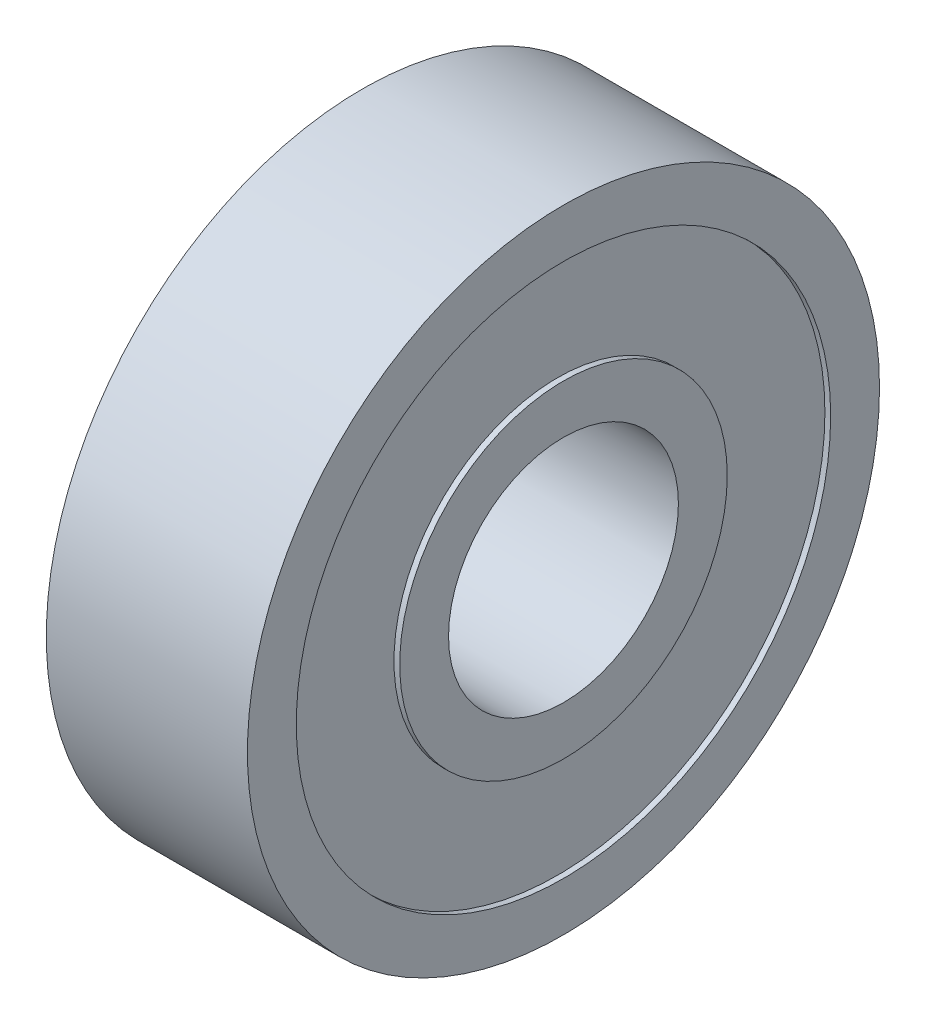
from build123d import *

# Parameters (mm, degrees)
ESQUISSE1_R             = 11
ESQUISSE1_R_2           = 4
BOSS_EXTRU_1_DEPTH      = 3.5
ESQUISSE2_R             = 9.3
ESQUISSE2_R_2           = 5.7
ENL_V_MAT_EXTRU_1_DEPTH = 0.2


with BuildPart() as part:
    # Esquisse1 → Boss.-Extru.1 (new, symmetric)
    with BuildSketch(Plane(origin=(0, 0, 0), x_dir=(0, 0, -1), z_dir=(1, 0, 0))):
        Circle(ESQUISSE1_R)
        Circle(ESQUISSE1_R_2, mode=Mode.SUBTRACT)
    extrude(amount=BOSS_EXTRU_1_DEPTH, both=True)

    # Esquisse2 → Enlèv. mat.-Extru.1 (cut)
    with BuildSketch(Plane(origin=(3.5, 0, 0), x_dir=(0, 0, -1), z_dir=(1, 0, 0))):
        Circle(ESQUISSE2_R)
        Circle(ESQUISSE2_R_2, mode=Mode.SUBTRACT)
    enl_v_mat_extru_1 = extrude(amount=-ENL_V_MAT_EXTRU_1_DEPTH, mode=Mode.SUBTRACT)

    # Symétrie1: Enlèv. mat.-Extru.1 across plane
    add(enl_v_mat_extru_1.mirror(Plane(origin=(0, 0, 0), x_dir=(0, 0, 1), z_dir=(1, 0, 0))), mode=Mode.SUBTRACT)


solid = part.part
